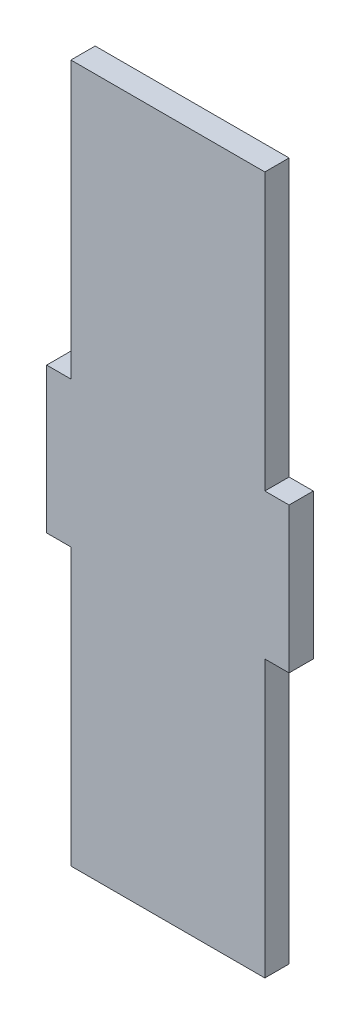
from build123d import *

# Parameters (mm, degrees)
BOSS_EXTRUDE1_DEPTH = 5


with BuildPart() as part:
    # Sketch1 → Boss-Extrude1 (new body)
    with BuildSketch(Plane.XY):
        Polygon((-20, -72), (20, -72), (20, -15), (25, -15), (25, 15), (20, 15), (20, 72), (-20, 72), (-20, 15), (-25, 15), (-25, -15), (-20, -15), align=None)
    extrude(amount=BOSS_EXTRUDE1_DEPTH)


solid = part.part
